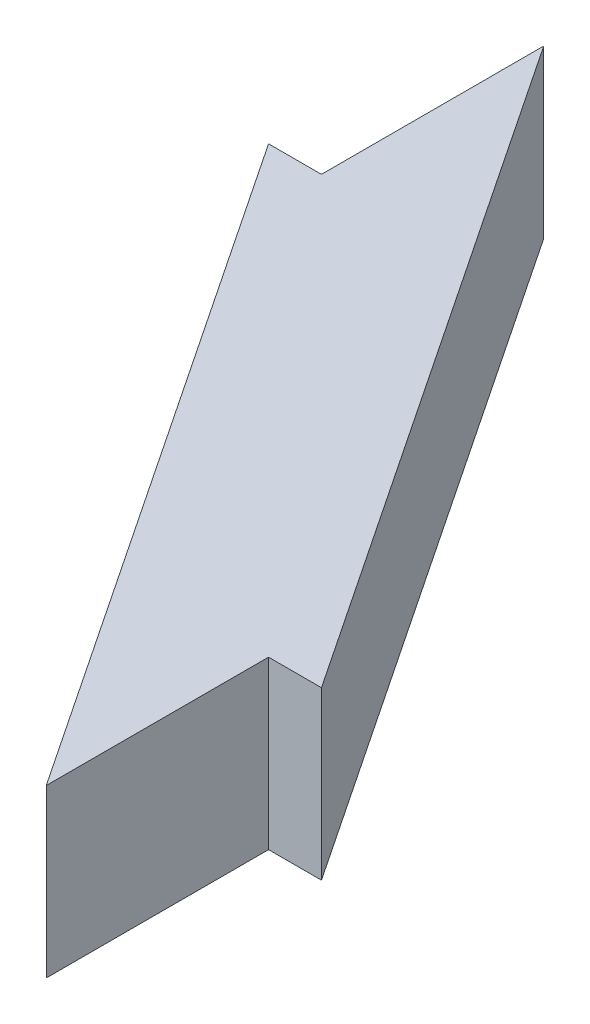
from build123d import *

# Parameters (mm, degrees)
BOSS_EXTRUDE1_DEPTH = 9.525


with BuildPart() as part:
    # Sketch1 → Boss-Extrude1 (new, symmetric)
    with BuildSketch(Plane(origin=(0, 0, 0), x_dir=(1, 0, 0), z_dir=(0, 1, 0))):
        Polygon((22.3774, -50.8), (-28.4226, 25.4), (-22.3774, 25.4), (-22.3774, 50.8), (28.4226, -25.4), (22.3774, -25.4), align=None)
    extrude(amount=BOSS_EXTRUDE1_DEPTH, both=True)


solid = part.part
